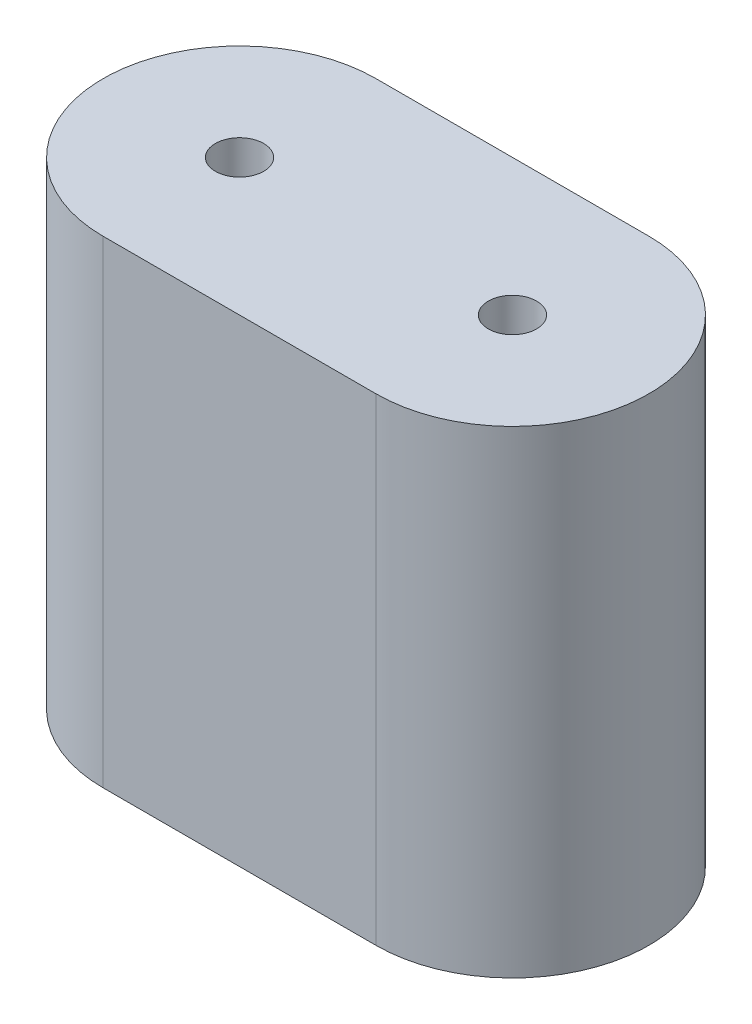
from build123d import *

# Parameters (mm, degrees)
BOSS_EXTRUDE1_DEPTH   = 44.45
F_8_CLEARANCE_HOLE1_D = 4.4958


with BuildPart() as part:
    # Sketch1 → Boss-Extrude1 (new body)
    with BuildSketch(Plane(origin=(0, 0, 0), x_dir=(1, 0, 0), z_dir=(0, 1, 0))):
        with BuildLine():
            Line((-12.7, 12.7), (12.7, 12.7))
            ThreePointArc((12.7, 12.7), (25.4, 0), (12.7, -12.7))
            Line((12.7, -12.7), (-12.7, -12.7))
            ThreePointArc((-12.7, -12.7), (-25.4, 0), (-12.7, 12.7))
        make_face()
    extrude(amount=BOSS_EXTRUDE1_DEPTH)

    # #8 Clearance Hole1 (through all)
    with Locations(Plane(origin=(0, 0, 0), x_dir=(-1, 0, 0), z_dir=(0, -1, 0))):
        with Locations((-12.7, 0), (12.7, 0)):
            Hole(F_8_CLEARANCE_HOLE1_D / 2)


solid = part.part
